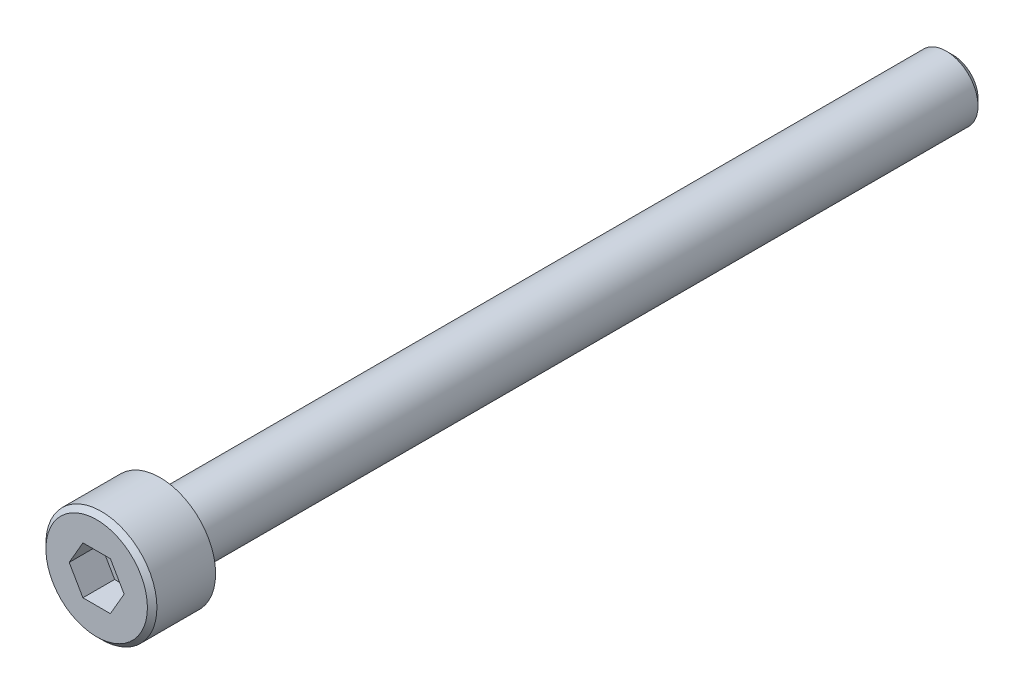
from build123d import *

# Parameters (mm, degrees)
CUT_EXTRUDE_1_DEPTH = 2


with BuildPart() as part:
    # 草图1 → 旋转1 (revolve)
    with BuildSketch(Plane(origin=(0, 0, 0), x_dir=(0, 0, -1), z_dir=(1, 0, 0))):
        Polygon((-4, 0), (-4, 3.2), (-3.7, 3.5), (0, 3.5), (0, 2), (49.5705, 2), (50, 1.5705), (50, 0), align=None)
    revolve(axis=Axis((0, 0, -50), (0, 0, 1)))

    # 草图2 → 切除-拉伸1 (cut)
    with BuildSketch(Plane.XY.offset(4)):
        Polygon((-0.866025404, -1.5), (0.866025404, -1.5), (1.732050808, 0), (0.866025404, 1.5), (-0.866025404, 1.5), (-1.732050808, 0), align=None)
    extrude(amount=-CUT_EXTRUDE_1_DEPTH, mode=Mode.SUBTRACT)


solid = part.part
